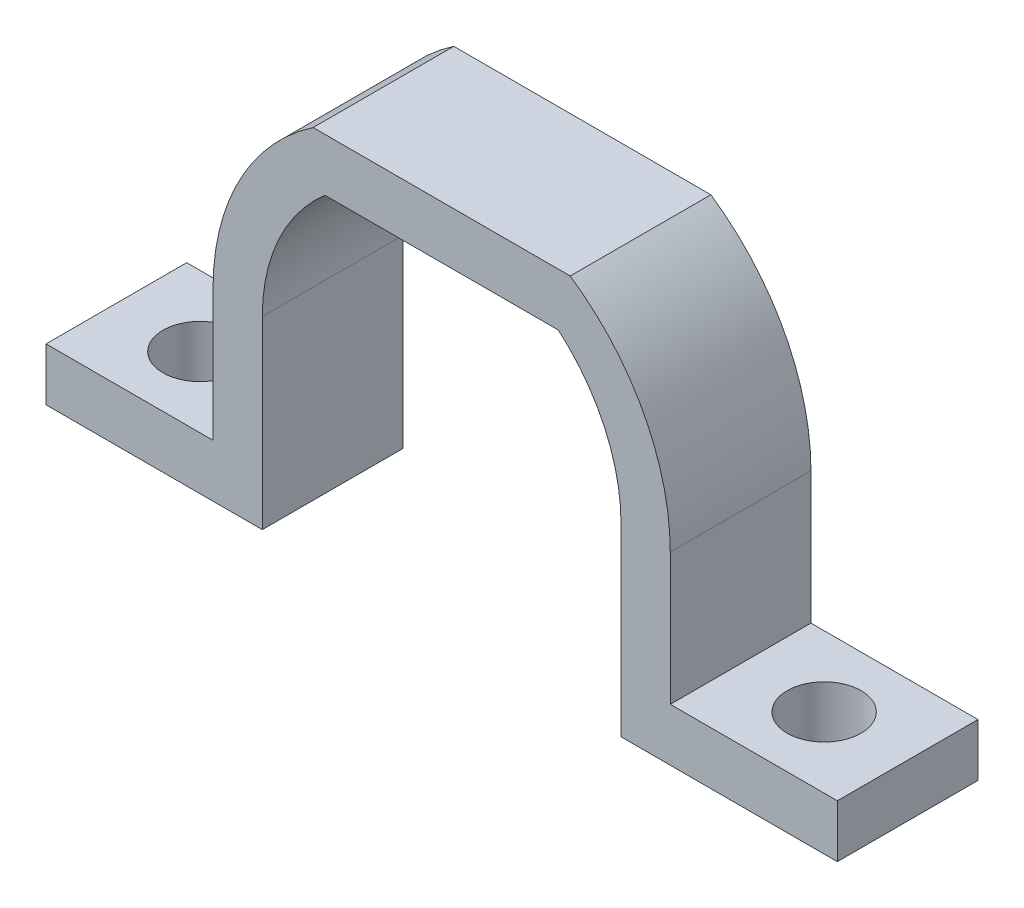
from build123d import *

# Parameters (mm, degrees)
CLAMP_DEPTH      = 8
SKETCH2_R        = 2.1
SCREW_HOLE_DEPTH = 31.055157627


with BuildPart() as part:
    # Sketch1 → Clamp (new body)
    with BuildSketch(Plane.XY):
        with BuildLine():
            Line((-6.631553363, 7.75), (6.631553363, 7.75))
            ThreePointArc((6.631553363, 7.75), (9.265037623, 4.266037723), (10.2, 0))
            Line((10.2, 0), (10.2, -10.5))
            Line((10.2, -10.5), (22.5, -10.5))
            Line((22.5, -10.5), (22.5, -7.5))
            Line((22.5, -7.5), (13, -7.5))
            Line((13, -7.5), (13, 0))
            ThreePointArc((13, 0), (11.489805152, 6.081478239), (7.310095759, 10.75))
            Line((7.310095759, 10.75), (-7.310095759, 10.75))
            ThreePointArc((-7.310095759, 10.75), (-11.489805152, 6.081478239), (-13, 0))
            Line((-13, 0), (-13, -7.5))
            Line((-13, -7.5), (-22.5, -7.5))
            Line((-22.5, -7.5), (-22.5, -10.5))
            Line((-22.5, -10.5), (-10.2, -10.5))
            Line((-10.2, -10.5), (-10.2, 0))
            ThreePointArc((-10.2, 0), (-9.265037623, 4.266037723), (-6.631553363, 7.75))
        make_face()
    extrude(amount=CLAMP_DEPTH)

    # Sketch2 → Screw Hole (cut, through all)
    with BuildSketch(Plane(origin=(0, -7.5, 0), x_dir=(1, 0, 0), z_dir=(0, 1, 0))):
        with Locations(Location((-17.75, -4, 0), (0, 0, 270))):
            Circle(SKETCH2_R)
        with Locations(Location((17.75, -4, 0), (0, 0, 270))):
            Circle(SKETCH2_R)
    extrude(amount=-SCREW_HOLE_DEPTH, mode=Mode.SUBTRACT)


solid = part.part
